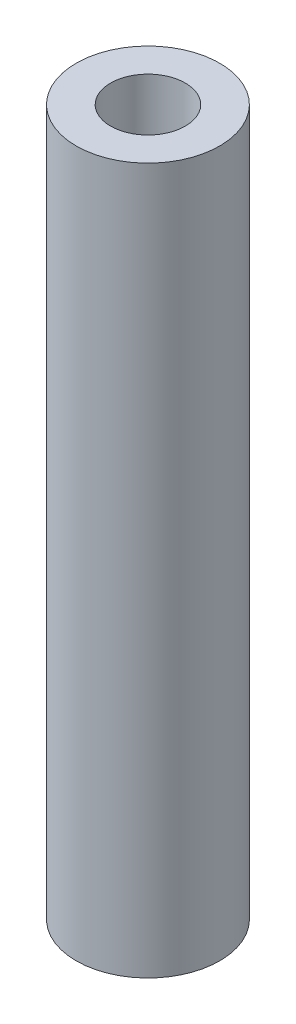
from build123d import *

# Parameters (mm, degrees)
SKETCH1_R           = 3.05
SKETCH1_R_2         = 1.5875
BOSS_EXTRUDE1_DEPTH = 15


with BuildPart() as part:
    # Sketch1 → Boss-Extrude1 (new, symmetric)
    with BuildSketch(Plane(origin=(0, 0, 0), x_dir=(1, 0, 0), z_dir=(0, 1, 0))):
        with Locations(Location((0, 0, 0), (0, 0, 270))):
            Circle(SKETCH1_R)
        with Locations(Location((0, 0, 0), (0, 0, 270))):
            Circle(SKETCH1_R_2, mode=Mode.SUBTRACT)
    extrude(amount=BOSS_EXTRUDE1_DEPTH, both=True)


solid = part.part
